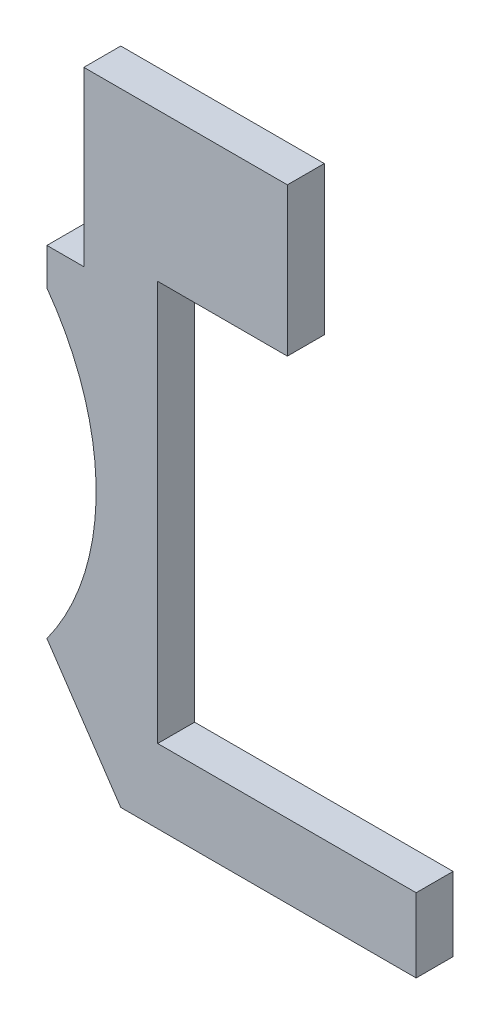
from build123d import *

# Parameters (mm, degrees)
BOSS_EXTRU_1_DEPTH = 5


with BuildPart() as part:
    # Esquisse1 → Boss.-Extru.1 (new body)
    with BuildSketch(Plane.XY):
        with BuildLine():
            Line((50, 0), (50, 10))
            Line((50, 10), (15, 10))
            Line((15, 10), (15, 64.203101523))
            Line((15, 64.203101523), (32.561057994, 64.203101523))
            Line((32.561057994, 64.203101523), (32.561057994, 84.294650344))
            Line((32.561057994, 84.294650344), (5, 84.294650344))
            Line((5, 84.294650344), (5, 60.912399745))
            Line((5, 60.912399745), (0, 60.912399745))
            Line((0, 60.912399745), (0, 55.912399745))
            ThreePointArc((0, 55.912399745), (6.66837561, 35.361996844), (0, 14.811593943))
            Line((0, 14.811593943), (10, 0))
            Line((10, 0), (50, 0))
        make_face()
    extrude(amount=BOSS_EXTRU_1_DEPTH)


solid = part.part
